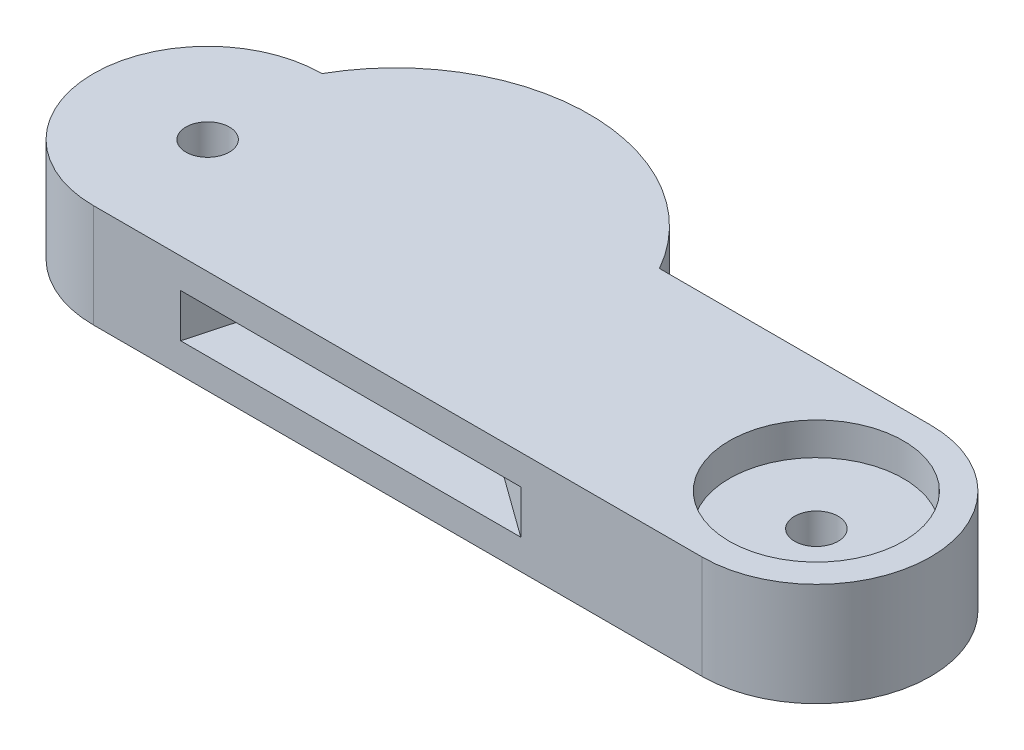
from build123d import *

# Parameters (mm, degrees)
SKETCH1_R                       = 2
BOSS_EXTRUDE1_DEPTH             = 4.75
CUT_EXTRUDE1_DEPTH              = 2
BOSS_EXTRUDE2_REACH             = 69.423
BOSS_EXTRUDE2_DIRECTION_2_REACH = 69.423
CUT_EXTRUDE2_DEPTH              = 2
SKETCH7_R                       = 8
CUT_EXTRUDE3_DEPTH              = 3


with BuildPart() as part:
    # Sketch1 → Boss-Extrude1 (new, symmetric)
    with BuildSketch(Plane(origin=(0, 0, 0), x_dir=(1, 0, 0), z_dir=(0, 1, 0))):
        with BuildLine():
            Line((0, -10.500399217), (-55.93053828, -10.500399217))
            ThreePointArc((-55.93053828, -10.500399217), (-66.430937497, 0), (-55.93053828, 10.500399217))
            Line((-55.93053828, 10.500399217), (0, 10.500399217))
            ThreePointArc((0, 10.500399217), (10.500399217, 0), (0, -10.500399217))
        make_face()
        with Locations(Location((0, 0, 0), (0, 0, 270))):
            Circle(SKETCH1_R, mode=Mode.SUBTRACT)
        with Locations(Location((-55.93053828, 0, 0), (0, 0, 270))):
            Circle(SKETCH1_R, mode=Mode.SUBTRACT)
    extrude(amount=BOSS_EXTRUDE1_DEPTH, both=True)

    # Sketch3 → Cut-Extrude1 (cut, symmetric)
    with BuildSketch(Plane(origin=(0, 0, 0), x_dir=(1, 0, 0), z_dir=(0, 1, 0))):
        with BuildLine():
            Line((-35.751827911, 18.875253657), (-39.299525946, 5.868950542))
            Line((-39.299525946, 5.868950542), (26.645239155, -41.810424095))
            ThreePointArc((26.645239155, -41.810424095), (-18.563858299, -45.972421055), (-48.206523525, -11.584965354))
            Line((-48.206523525, -11.584965354), (-43.887265107, 4.249974277))
            Line((-43.887265107, 4.249974277), (-54.812276631, 12.148974547))
            ThreePointArc((-54.812276631, 12.148974547), (-46.585078234, 19.204535889), (-35.751827911, 18.875253657))
        make_face()
    extrude(amount=CUT_EXTRUDE1_DEPTH, both=True, mode=Mode.SUBTRACT)

    # Boss-Extrude2: up to this face of the body (flat: up to its plane)
    boss_extrude2_end = Plane(part.part.faces().sort_by_distance((-27.96526914, 4.75, 0))[0])
    # Sketch5 → Boss-Extrude2 (add, up to the picked face)
    with BuildSketch(Plane(origin=(0, 0, 0), x_dir=(1, 0, 0), z_dir=(0, 1, 0)), mode=Mode.PRIVATE) as boss_extrude2_sk1:
        with BuildLine():
            ThreePointArc((-24.917700351, 10.500399217), (-40.424119316, 19.553005923), (-55.93053828, 10.500399217))
            Line((-55.93053828, 10.500399217), (-24.917700351, 10.500399217))
        make_face()
    boss_extrude2_tool1 = split(extrude(boss_extrude2_sk1.sketch, amount=BOSS_EXTRUDE2_REACH, mode=Mode.PRIVATE), bisect_by=boss_extrude2_end, keep=Keep.BOTH, mode=Mode.PRIVATE)
    add(boss_extrude2_tool1.solids().sort_by(Axis((-40.424119, 0, -14.214125), (0, 1, 0)))[0])

    # Boss-Extrude2 direction 2: up to this face of the body (flat: up to its plane)
    boss_extrude2_direction_2_end = Plane(part.part.faces().sort_by_distance((-27.96526914, -4.75, 0))[0])
    # Sketch5 → Boss-Extrude2 direction 2 (add, up to the picked face)
    with BuildSketch(Plane(origin=(0, 0, 0), x_dir=(1, 0, 0), z_dir=(0, 1, 0)), mode=Mode.PRIVATE) as boss_extrude2_direction_2_sk1:
        with BuildLine():
            ThreePointArc((-24.917700351, 10.500399217), (-40.424119316, 19.553005923), (-55.93053828, 10.500399217))
            Line((-55.93053828, 10.500399217), (-24.917700351, 10.500399217))
        make_face()
    boss_extrude2_direction_2_tool1 = split(extrude(boss_extrude2_direction_2_sk1.sketch, amount=-BOSS_EXTRUDE2_DIRECTION_2_REACH, mode=Mode.PRIVATE), bisect_by=boss_extrude2_direction_2_end, keep=Keep.BOTH, mode=Mode.PRIVATE)
    add(boss_extrude2_direction_2_tool1.solids().sort_by(Axis((-40.424119, 0, -14.214125), (0, -1, 0)))[0])

    # Sketch6 → Cut-Extrude2 (cut, symmetric)
    with BuildSketch(Plane(origin=(0, 0, 0), x_dir=(1, 0, 0), z_dir=(0, 1, 0))):
        with BuildLine():
            Line((-39.299525946, 5.868950542), (-16.659276721, -10.500399217))
            Line((-16.659276721, -10.500399217), (-47.910689027, -10.500399217))
            Line((-47.910689027, -10.500399217), (-43.887265107, 4.249974277))
            Line((-43.887265107, 4.249974277), (-54.854382526, 12.179417945))
            ThreePointArc((-54.854382526, 12.179417945), (-46.349897212, 18.538096729), (-35.738154791, 18.925381021))
            Line((-35.738154791, 18.925381021), (-39.299525946, 5.868950542))
        make_face()
    extrude(amount=CUT_EXTRUDE2_DEPTH, both=True, mode=Mode.SUBTRACT)

    # Sketch7 → Cut-Extrude3 (cut)
    with BuildSketch(Plane(origin=(0, 4.75, 0), x_dir=(1, 0, 0), z_dir=(0, 1, 0))):
        with Locations(Location((0, 0, 0), (0, 0, 270))):
            Circle(SKETCH7_R)
    extrude(amount=-CUT_EXTRUDE3_DEPTH, mode=Mode.SUBTRACT)


solid = part.part
